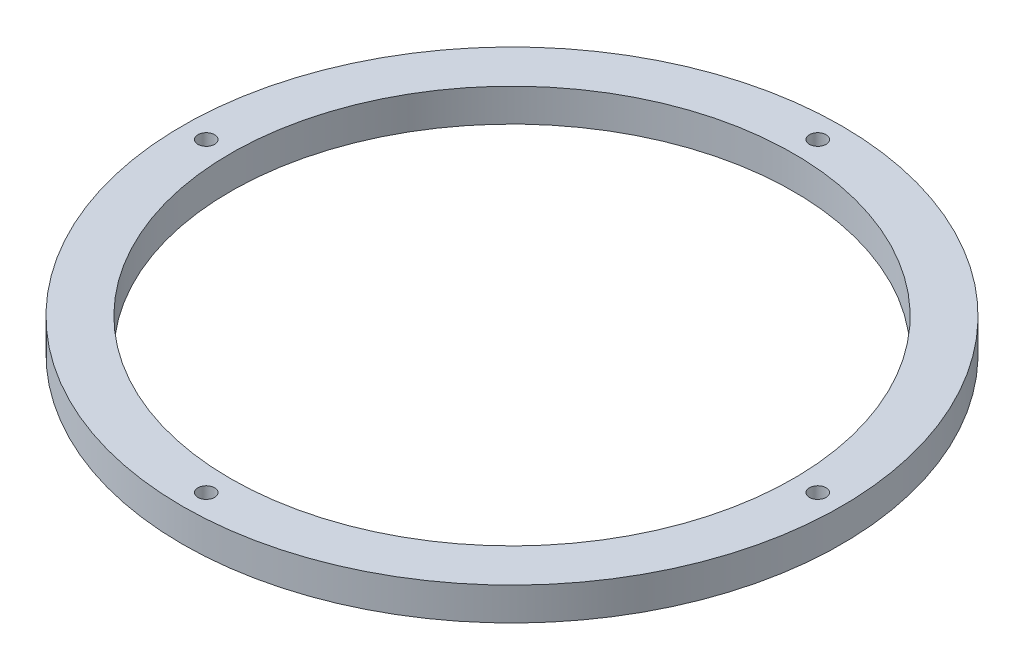
from build123d import *

# Parameters (mm, degrees)
SKETCH1_R                                          = 100.375000037
SKETCH1_R_2                                        = 85.74999995
BOSS_EXTRUDE1_DEPTH                                = 5.000000033
SKETCH2_R                                          = 1.27
CUT_EXTRUDE1_DEPTH                                 = 143.03971721
CIRPATTERN1_COUNT                                  = 4
CSK_FOR_10_FLAT_HEAD_MACHINE_SCREW_100_D           = 5.1054
CSK_FOR_10_FLAT_HEAD_MACHINE_SCREW_100_CSINK_D     = 9.779
CSK_FOR_10_FLAT_HEAD_MACHINE_SCREW_100_CSINK_ANGLE = 100


with BuildPart() as part:
    # Sketch1 → Boss-Extrude1 (new, symmetric)
    with BuildSketch(Plane(origin=(0, 0, 0), x_dir=(1, 0, 0), z_dir=(0, 1, 0))):
        with Locations(Location((0, 0, 0), (0, 0, 270))):
            Circle(SKETCH1_R)
        with Locations(Location((0, 0, 0), (0, 0, 270))):
            Circle(SKETCH1_R_2, mode=Mode.SUBTRACT)
    extrude(amount=BOSS_EXTRUDE1_DEPTH, both=True)

    # Sketch2 → Cut-Extrude1 (cut, symmetric)
    with BuildSketch(Plane(origin=(0, 0, 0), x_dir=(1, 0, 0), z_dir=(0, 1, 0))):
        with Locations(Location((-93.125000059, 0, 0), (0, 0, 270))):
            Circle(SKETCH2_R)
    cut_extrude1 = extrude(amount=CUT_EXTRUDE1_DEPTH, both=True, mode=Mode.SUBTRACT)

    # CirPattern1: Cut-Extrude1 ×4 about axis
    cirpattern1_axis = Axis((0, 0, 0), (0, 1, 0))
    for i in range(1, CIRPATTERN1_COUNT):
        add(cut_extrude1.rotate(cirpattern1_axis, i * 360 / CIRPATTERN1_COUNT), mode=Mode.SUBTRACT)

    # CSK for #10 Flat Head Machine Screw (100)1 (through all)
    with Locations(Plane(origin=(93.125000059, -5.000000033, 0), x_dir=(0, 0, -1), z_dir=(0, -1, 0))):
        with Locations((0, 0), (93.125000059, -93.125000059), (0, -186.250000118), (-93.125000059, -93.125000059)):
            CounterSinkHole(CSK_FOR_10_FLAT_HEAD_MACHINE_SCREW_100_D / 2, CSK_FOR_10_FLAT_HEAD_MACHINE_SCREW_100_CSINK_D / 2, counter_sink_angle=CSK_FOR_10_FLAT_HEAD_MACHINE_SCREW_100_CSINK_ANGLE)


solid = part.part
